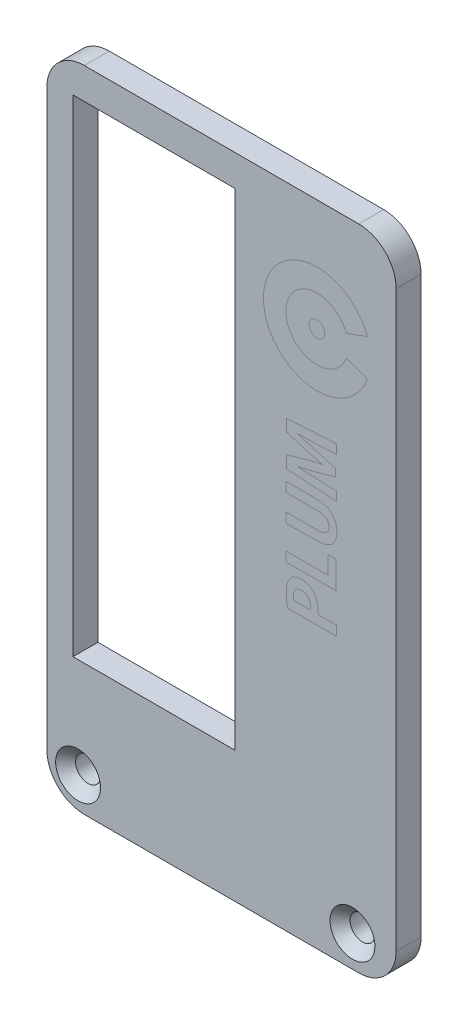
from build123d import *

# Parameters (mm, degrees)
SKETCH_1_W          = 28
SKETCH_1_H          = 52
EXTRUDE_1_DEPTH     = 2
SKETCH_2_R          = 1
CUT_EXTRUDE_1_DEPTH = 2
SKETCH_3_W          = 13
SKETCH_3_H          = 39
CUT_EXTRUDE_2_DEPTH = 2
FILLET_1_R          = 3
CHAMFER_1_SIZE      = 0.8
CUT_EXTRUDE_3_DEPTH = 2
EXTRUDE_2_DEPTH     = 2
SKETCH_6_R          = 0.626877417
CUT_EXTRUDE_4_DEPTH = 2
SKETCH_6_3_R        = 0.626877417
EXTRUDE_4_DEPTH     = 2
CUT_EXTRUDE_7_DEPTH = 2
EXTRUDE_5_DEPTH     = 2
EXTRUDE_5_2_DEPTH   = 2
EXTRUDE_5_3_DEPTH   = 2
EXTRUDE_5_4_DEPTH   = 2


with BuildPart() as part:
    # 草图1 → 凸台-拉伸1 (new body)
    with BuildSketch(Plane.XY):
        Rectangle(SKETCH_1_W, SKETCH_1_H)
    extrude(amount=EXTRUDE_1_DEPTH)

    # 草图2 → 切除-拉伸1 (cut)
    with BuildSketch(Plane.XY.offset(2)):
        with Locations((-11.5, -23.5)):
            Circle(SKETCH_2_R)
        with Locations((10.5, -23.5)):
            Circle(SKETCH_2_R)
    extrude(amount=-CUT_EXTRUDE_1_DEPTH, mode=Mode.SUBTRACT)

    # 草图3 → 切除-拉伸2 (cut)
    with BuildSketch(Plane.XY.offset(2)):
        with Locations((-5.4104633, 4)):
            Rectangle(SKETCH_3_W, SKETCH_3_H)
    extrude(amount=-CUT_EXTRUDE_2_DEPTH, mode=Mode.SUBTRACT)

    # 圆角1
    fillet_1_edges = [part.edges().sort_by_distance(p)[0] for p in [
        (-14, -26, 1),
        (14, -26, 1),
        (14, 26, 1),
        (-14, 26, 1),
    ]]
    fillet(fillet_1_edges, radius=FILLET_1_R)

    # 倒角1
    chamfer_1_edges = [part.edges().sort_by_distance(p)[0] for p in [
        (-12.5, -23.5, 2),
        (9.5, -23.5, 2),
    ]]
    chamfer(chamfer_1_edges, length=CHAMFER_1_SIZE)

    # 草图4 → 切除-拉伸3 (cut)
    with BuildSketch(Plane.XY.offset(2)):
        with BuildLine():
            Line((10.001874871, 17.901227001), (11.690547955, 18.524430993))
            ThreePointArc((11.690547955, 18.524430993), (3.356538696, 17.016411498), (11.703718742, 15.583087248))
            Line((11.703718742, 15.583087248), (10.009532305, 16.191143429))
            ThreePointArc((10.009532305, 16.191143429), (5.156520651, 17.024471481), (10.001874871, 17.901227001))
        make_face()
    extrude(amount=-CUT_EXTRUDE_3_DEPTH, mode=Mode.SUBTRACT)

    # 草图6 → 切除-拉伸4 (cut)
    with BuildSketch(Plane.XY.offset(2)):
        with Locations((7.656495588, 17.035665901)):
            Circle(SKETCH_6_R)
    extrude(amount=-CUT_EXTRUDE_4_DEPTH, mode=Mode.SUBTRACT)

    # 草图7 → 切除-拉伸7 (cut)
    # profile 1 of 4: a face of its own
    with BuildSketch(Plane.XY.offset(2)):
        with BuildLine():
            Line((9.224567312, -2.754985204), (7.723029281, -2.754985204))
            add(Edge.make_bspline(
                [(7.723029281, -2.754985204), (7.726556807, -2.734910954), (7.733977657, -2.692680784), (7.740165236, -2.62613634), (7.744136952, -2.553678568), (7.744142034, -2.503609044), (7.744144688, -2.477458758)],
                knots=[0, 0, 0, 0, 0.877062455, 1.845075036, 2.874526838, 4, 4, 4, 4], degree=3))
            add(Edge.make_bspline(
                [(7.744144688, -2.477458758), (7.744761866, -2.437225534), (7.746001804, -2.356395332), (7.736609044, -2.234814224), (7.717668876, -2.112792971), (7.688752463, -1.990642596), (7.650875383, -1.868232888), (7.6039841, -1.745441449), (7.546893534, -1.622851311), (7.482874728, -1.500234775), (7.405880901, -1.383198746), (7.308990083, -1.280188659), (7.195854553, -1.191449891), (7.065587986, -1.118090926), (6.919673904, -1.058406831), (6.756868185, -1.013664661), (6.577753052, -0.982701427), (6.452413214, -0.974281958), (6.387432522, -0.969917002)],
                knots=[0, 0, 0, 0, 0.84128718, 1.690180573, 2.546870841, 3.421794341, 4.313246192, 5.225301024, 6.168735534, 7.140236699, 8.117328017, 9.088302565, 10.084421092, 11.113561656, 12.205223455, 13.373835019, 14.63850139, 16, 16, 16, 16], degree=3))
            add(Edge.make_bspline(
                [(6.387432522, -0.969917002), (6.341601648, -0.971192097), (6.251770782, -0.973691348), (6.120465814, -0.994186278), (5.995369675, -1.025307686), (5.877633284, -1.070029278), (5.768170286, -1.125764242), (5.668114564, -1.191555085), (5.577509848, -1.267218251), (5.526223597, -1.325910696), (5.500554531, -1.355286605)],
                knots=[0, 0, 0, 0, 1.100414086, 2.156868082, 3.185052495, 4.192238179, 5.175310638, 6.130003319, 7.064055837, 8, 8, 8, 8], degree=3))
            add(Edge.make_bspline(
                [(5.500554531, -1.355286605), (5.47562324, -1.388692876), (5.425022493, -1.456494509), (5.362575853, -1.570489942), (5.309855817, -1.695393788), (5.267138003, -1.83182479), (5.233768151, -1.979583039), (5.212226323, -2.138826289), (5.198014625, -2.309273785), (5.197103456, -2.426647837), (5.196632906, -2.487262681)],
                knots=[0, 0, 0, 0, 0.836606025, 1.697982253, 2.603178176, 3.556730869, 4.566307281, 5.642647, 6.782605007, 8, 8, 8, 8], degree=3))
            add(Edge.make_bspline(
                [(5.196632906, -2.487262681), (5.197118973, -2.540813077), (5.198061676, -2.644671334), (5.203856312, -2.796249277), (5.21054157, -2.938791795), (5.218290488, -3.072882215), (5.229937103, -3.197536044), (5.242608805, -3.313741483), (5.257158918, -3.420979067), (5.269787023, -3.489315105), (5.275818441, -3.521953671)],
                knots=[0, 0, 0, 0, 1.236942669, 2.398987101, 3.50349081, 4.533253662, 5.501087568, 6.394974819, 7.233410034, 8, 8, 8, 8], degree=3))
            Line((5.275818441, -3.521953671), (9.224567312, -3.52120026))
            Line((9.224567312, -3.52120026), (9.224567312, -2.754985204))
        make_face()
        with BuildLine():
            add(Edge.make_bspline(
                [(5.801190015, -2.754985204), (5.796614825, -2.735948789), (5.786175188, -2.69251163), (5.778920182, -2.617830653), (5.771438564, -2.527124741), (5.770366014, -2.461143778), (5.76978535, -2.425422549)],
                knots=[0, 0, 0, 0, 0.707411116, 1.614165824, 2.708340608, 4, 4, 4, 4], degree=3))
            add(Edge.make_bspline(
                [(5.76978535, -2.425422549), (5.770055574, -2.399501658), (5.770584409, -2.348773816), (5.7794984, -2.27499038), (5.791847425, -2.205271436), (5.809970176, -2.14009608), (5.833474564, -2.079218856), (5.862179469, -2.022726518), (5.895543903, -1.969805349), (5.934699396, -1.92188491), (5.978715727, -1.878333901), (6.027871022, -1.840630291), (6.081957602, -1.808497504), (6.141220648, -1.783161304), (6.205088275, -1.762662539), (6.273744341, -1.747645282), (6.347482965, -1.738656292), (6.398216945, -1.736990529), (6.424385772, -1.736131321)],
                knots=[0, 0, 0, 0, 1.150647283, 2.251845908, 3.296564491, 4.293585939, 5.251638342, 6.190496202, 7.10431693, 8.025138136, 8.933209785, 9.848938853, 10.770098533, 11.720244083, 12.705502524, 13.745915437, 14.837332513, 16, 16, 16, 16], degree=3))
            add(Edge.make_bspline(
                [(6.424385772, -1.736131321), (6.451049986, -1.737034193), (6.503270946, -1.738802436), (6.579396235, -1.747352063), (6.650984599, -1.763634428), (6.718165079, -1.785008594), (6.78045417, -1.81362727), (6.839223256, -1.846446717), (6.892834106, -1.886901114), (6.941939514, -1.932879214), (6.985871292, -1.984536854), (7.024601092, -2.041263051), (7.056946492, -2.103384648), (7.08351477, -2.170655567), (7.104436079, -2.242621062), (7.119377109, -2.319876162), (7.129449159, -2.401784577), (7.130988577, -2.458322786), (7.131776551, -2.487262681)],
                knots=[0, 0, 0, 0, 1.095871145, 2.146226514, 3.140886829, 4.107544356, 5.036565894, 5.952407514, 6.867375378, 7.787920949, 8.710896167, 9.647520347, 10.603695434, 11.581704824, 12.614397299, 13.677669427, 14.811281692, 16, 16, 16, 16], degree=3))
            add(Edge.make_bspline(
                [(7.131776551, -2.487262681), (7.131772461, -2.513413064), (7.131764668, -2.563231688), (7.127913009, -2.634189383), (7.121768905, -2.697504308), (7.114198884, -2.73667537), (7.110660408, -2.754985204)],
                knots=[0, 0, 0, 0, 1.166081162, 2.221480295, 3.168661808, 4, 4, 4, 4], degree=3))
            Line((7.110660408, -2.754985204), (5.801190015, -2.754985204))
        make_face(mode=Mode.SUBTRACT)
    # profile 2 of 4: a face of its own
    with BuildSketch(Plane.XY.offset(2)):
        Polygon((8.528175752, 0.382270276), (5.171162738, 0.382270276), (5.171162738, -0.38394478), (9.195408152, -0.38394478), (9.195408152, 1.815777386), (8.528175752, 1.815777386), align=None)
    # profile 3 of 4: a face of its own
    with BuildSketch(Plane.XY.offset(2)):
        with BuildLine():
            Line((5.188276888, 4.442601375), (7.612207093, 4.442601375))
            add(Edge.make_bspline(
                [(7.612207093, 4.442601375), (7.65494803, 4.44177156), (7.737521985, 4.440168387), (7.857053632, 4.430909341), (7.967740453, 4.417270654), (8.069260699, 4.396804698), (8.161602049, 4.371359075), (8.245233171, 4.340786507), (8.319509666, 4.303717412), (8.385236045, 4.261382707), (8.441748701, 4.213310793), (8.491969461, 4.162098413), (8.532247598, 4.104667539), (8.56714198, 4.044300226), (8.592355646, 3.978452724), (8.611570737, 3.909105853), (8.622171946, 3.834836889), (8.623036127, 3.78401233), (8.623481199, 3.757836508)],
                knots=[0, 0, 0, 0, 1.481883634, 2.862945906, 4.154826069, 5.346215526, 6.450063801, 7.473233258, 8.428200081, 9.322663588, 10.176367081, 10.996254644, 11.801747258, 12.601751253, 13.407762399, 14.238693956, 15.092886716, 16, 16, 16, 16], degree=3))
            add(Edge.make_bspline(
                [(8.623481199, 3.757836508), (8.623105058, 3.732902529), (8.622367549, 3.684013877), (8.610605542, 3.6129024), (8.59179895, 3.545776491), (8.564978459, 3.482554259), (8.531132164, 3.422860294), (8.489323701, 3.367068533), (8.438541607, 3.316597889), (8.381230798, 3.26868107), (8.315379974, 3.225543124), (8.240525454, 3.188670593), (8.157266753, 3.15689571), (8.064943374, 3.131806427), (7.964163526, 3.111495182), (7.854618968, 3.096486599), (7.736241199, 3.087680437), (7.654415777, 3.08600274), (7.612168796, 3.085136535)],
                knots=[0, 0, 0, 0, 0.872717099, 1.711157419, 2.516945564, 3.310362728, 4.111176974, 4.916242676, 5.744629168, 6.61414003, 7.530271028, 8.495355153, 9.532473613, 10.648016501, 11.843394681, 13.132666545, 14.519577664, 16, 16, 16, 16], degree=3))
            Line((7.612168796, 3.085136535), (5.188276888, 3.085136535))
            Line((5.188276888, 3.085136535), (5.188276888, 2.318921479))
            Line((5.188276888, 2.318921479), (7.544441302, 2.318921479))
            add(Edge.make_bspline(
                [(7.544441302, 2.318921479), (7.615064667, 2.320092169), (7.752058515, 2.322363049), (7.950128668, 2.339412999), (8.133860441, 2.368772188), (8.302922789, 2.409067346), (8.458006863, 2.460405752), (8.599094324, 2.522102198), (8.724511882, 2.597877331), (8.836424267, 2.683041365), (8.933846259, 2.779987889), (9.017985328, 2.886969924), (9.089458793, 3.004133983), (9.147682019, 3.131450433), (9.192037415, 3.268989879), (9.223371772, 3.416040909), (9.242820525, 3.573047345), (9.244192826, 3.681105736), (9.244899112, 3.736720365)],
                knots=[0, 0, 0, 0, 1.337524362, 2.594504072, 3.761585457, 4.858651196, 5.882479242, 6.85223788, 7.768398263, 8.651190312, 9.509702829, 10.36409947, 11.223126735, 12.103025156, 13.009434111, 13.954508992, 14.947243024, 16, 16, 16, 16], degree=3))
            add(Edge.make_bspline(
                [(9.244899112, 3.736720365), (9.243864404, 3.793085631), (9.241848845, 3.902882274), (9.222632273, 4.062652379), (9.191282377, 4.21302761), (9.146409126, 4.353890329), (9.086672964, 4.484391469), (9.015943447, 4.606211459), (8.930681528, 4.717774771), (8.832065137, 4.8193808), (8.71992531, 4.910419685), (8.593155631, 4.989343719), (8.45220884, 5.056409444), (8.296901551, 5.111111807), (8.127530727, 5.154082306), (7.944115883, 5.18434127), (7.746292377, 5.203274854), (7.609699099, 5.206430219), (7.539016445, 5.208063019)],
                knots=[0, 0, 0, 0, 1.051511199, 2.048289845, 2.997825919, 3.91467537, 4.800664648, 5.671218089, 6.538186984, 7.414033205, 8.307886667, 9.226846025, 10.194166529, 11.215029432, 12.294813379, 13.450900938, 14.680922724, 16, 16, 16, 16], degree=3))
            Line((7.539016445, 5.208063019), (5.188276888, 5.208816431))
            Line((5.188276888, 5.208816431), (5.188276888, 4.442601375))
        make_face()
    # profile 4 of 4: a face of its own
    with BuildSketch(Plane.XY.offset(2)):
        with BuildLine():
            Line((5.196633643, 8.658695695), (6.695335518, 8.204801734))
            add(Edge.make_bspline(
                [(6.695335518, 8.204801734), (6.815807413, 8.171246442), (7.054280803, 8.104823944), (7.41041406, 8.014152054), (7.760381809, 7.929544473), (7.992650251, 7.879766767), (8.107644, 7.85512233)],
                knots=[0, 0, 0, 0, 1.031209753, 2.041273477, 3.030254364, 4, 4, 4, 4], degree=3))
            Line((8.107644, 7.85512233), (8.107991615, 7.839599697))
            add(Edge.make_bspline(
                [(8.107991615, 7.839599697), (7.992386878, 7.816098981), (7.75928919, 7.768713703), (7.408614859, 7.688079387), (7.053035862, 7.600878946), (6.815177657, 7.537291698), (6.695124887, 7.505197681)],
                knots=[0, 0, 0, 0, 0.974792936, 1.965507516, 2.973142592, 4, 4, 4, 4], degree=3))
            Line((6.695124887, 7.505197681), (5.196633643, 7.072675418))
            Line((5.196633643, 7.072675418), (5.196633643, 6.117932949))
            Line((5.196633643, 6.117932949), (9.197457019, 5.846825598))
            Line((9.197457019, 5.846825598), (9.197457019, 6.550958222))
            Line((9.197457019, 6.550958222), (7.654482093, 6.629215801))
            add(Edge.make_bspline(
                [(7.654482093, 6.629215801), (7.525254072, 6.63584842), (7.260584822, 6.649432549), (6.859818516, 6.666005134), (6.457390382, 6.681724841), (6.190358295, 6.688264377), (6.059378163, 6.691472041)],
                knots=[0, 0, 0, 0, 0.972684063, 1.992134205, 3.015135118, 4, 4, 4, 4], degree=3))
            Line((6.059378163, 6.691472041), (6.059379636, 6.707473381))
            add(Edge.make_bspline(
                [(6.059379636, 6.707473381), (6.184439084, 6.731971204), (6.437407036, 6.781524951), (6.814369307, 6.866587919), (7.184925817, 6.956217433), (7.426572089, 7.023635452), (7.54429548, 7.056479649)],
                knots=[0, 0, 0, 0, 1.002162323, 2.027155512, 3.03888464, 4, 4, 4, 4], degree=3))
            Line((7.54429548, 7.056479649), (9.140116735, 7.500483519))
            Line((9.140116735, 7.500483519), (9.140116735, 8.084806779))
            Line((9.140116735, 8.084806779), (7.518950512, 8.575220944))
            add(Edge.make_bspline(
                [(7.518950512, 8.575220944), (7.402284705, 8.609702782), (7.163426033, 8.680300041), (6.799473234, 8.782559715), (6.429661163, 8.880440465), (6.18189425, 8.941211274), (6.059378163, 8.971261299)],
                knots=[0, 0, 0, 0, 0.965166448, 1.976057779, 2.999198567, 4, 4, 4, 4], degree=3))
            Line((6.059378163, 8.971261299), (6.059379636, 8.987377529))
            add(Edge.make_bspline(
                [(6.059379636, 8.987377529), (6.114432596, 8.986782002), (6.229067556, 8.985541956), (6.408055033, 8.988705807), (6.601133806, 8.992020868), (6.875637596, 9.000619848), (7.223066832, 9.012169025), (7.501313997, 9.023156695), (7.638563974, 9.028576543)],
                knots=[0, 0, 0, 0, 0.627240715, 1.30608261, 2.039427526, 2.827383376, 4.435054818, 6, 6, 6, 6], degree=3))
            Line((7.638563974, 9.028576543), (9.197457019, 9.102155312))
            Line((9.197457019, 9.102155312), (9.197457019, 9.837776559))
            Line((9.197457019, 9.837776559), (5.196633643, 9.608220993))
            Line((5.196633643, 9.608220993), (5.196633643, 8.658695695))
        make_face()
    extrude(amount=-CUT_EXTRUDE_7_DEPTH, mode=Mode.SUBTRACT)


with BuildPart() as body_2:
    # 草图5 → 凸台-拉伸2 (new body)
    with BuildSketch(Plane.XY.offset(2)):
        with BuildLine():
            Line((11.703718742, 15.583087248), (10.009532305, 16.191143429))
            ThreePointArc((10.009532305, 16.191143429), (5.156520651, 17.024471481), (10.001874871, 17.901227001))
            Line((10.001874871, 17.901227001), (11.690547955, 18.524430993))
            ThreePointArc((11.690547955, 18.524430993), (3.356538696, 17.016411498), (11.703718742, 15.583087248))
        make_face()
    extrude(amount=-EXTRUDE_2_DEPTH)


with BuildPart() as body_3:
    # 草图6<3> → 凸台-拉伸4 (new body)
    with BuildSketch(Plane.XY.offset(2)):
        with Locations((7.656495588, 17.035665901)):
            Circle(SKETCH_6_3_R)
    extrude(amount=-EXTRUDE_4_DEPTH)


with BuildPart() as cut_extrude_7_piece_1:
    # of the separate pieces the step leaves, piece 1, a body of its own (cut_extrude_7_pieces)
    add(part.part.solids().sort_by_distance((-11, -26, 2))[0])


with BuildPart() as cut_extrude_7_piece_2:
    # of the separate pieces the step leaves, piece 2, a body of its own (cut_extrude_7_pieces)
    add(part.part.solids().sort_by_distance((5.801190015, -2.754985204, 2))[0])


with BuildPart() as body_5:
    # 草图7<2> → 凸台-拉伸5 (new body)
    with BuildSketch(Plane.XY.offset(2)):
        with BuildLine():
            Line((9.224567312, -2.754985204), (7.723029281, -2.754985204))
            add(Edge.make_bspline(
                [(7.723029281, -2.754985204), (7.726556807, -2.734910954), (7.733977657, -2.692680784), (7.740165236, -2.62613634), (7.744136952, -2.553678568), (7.744142034, -2.503609044), (7.744144688, -2.477458758)],
                knots=[0, 0, 0, 0, 0.877062455, 1.845075036, 2.874526838, 4, 4, 4, 4], degree=3))
            add(Edge.make_bspline(
                [(7.744144688, -2.477458758), (7.744761866, -2.437225534), (7.746001804, -2.356395332), (7.736609044, -2.234814224), (7.717668876, -2.112792971), (7.688752463, -1.990642596), (7.650875383, -1.868232888), (7.6039841, -1.745441449), (7.546893534, -1.622851311), (7.482874728, -1.500234775), (7.405880901, -1.383198746), (7.308990083, -1.280188659), (7.195854553, -1.191449891), (7.065587986, -1.118090926), (6.919673904, -1.058406831), (6.756868185, -1.013664661), (6.577753052, -0.982701427), (6.452413214, -0.974281958), (6.387432522, -0.969917002)],
                knots=[0, 0, 0, 0, 0.84128718, 1.690180573, 2.546870841, 3.421794341, 4.313246192, 5.225301024, 6.168735534, 7.140236699, 8.117328017, 9.088302565, 10.084421092, 11.113561656, 12.205223455, 13.373835019, 14.63850139, 16, 16, 16, 16], degree=3))
            add(Edge.make_bspline(
                [(6.387432522, -0.969917002), (6.341601648, -0.971192097), (6.251770782, -0.973691348), (6.120465814, -0.994186278), (5.995369675, -1.025307686), (5.877633284, -1.070029278), (5.768170286, -1.125764242), (5.668114564, -1.191555085), (5.577509848, -1.267218251), (5.526223597, -1.325910696), (5.500554531, -1.355286605)],
                knots=[0, 0, 0, 0, 1.100414086, 2.156868082, 3.185052495, 4.192238179, 5.175310638, 6.130003319, 7.064055837, 8, 8, 8, 8], degree=3))
            add(Edge.make_bspline(
                [(5.500554531, -1.355286605), (5.47562324, -1.388692876), (5.425022493, -1.456494509), (5.362575853, -1.570489942), (5.309855817, -1.695393788), (5.267138003, -1.83182479), (5.233768151, -1.979583039), (5.212226323, -2.138826289), (5.198014625, -2.309273785), (5.197103456, -2.426647837), (5.196632906, -2.487262681)],
                knots=[0, 0, 0, 0, 0.836606025, 1.697982253, 2.603178176, 3.556730869, 4.566307281, 5.642647, 6.782605007, 8, 8, 8, 8], degree=3))
            add(Edge.make_bspline(
                [(5.196632906, -2.487262681), (5.197118973, -2.540813077), (5.198061676, -2.644671334), (5.203856312, -2.796249277), (5.21054157, -2.938791795), (5.218290488, -3.072882215), (5.229937103, -3.197536044), (5.242608805, -3.313741483), (5.257158918, -3.420979067), (5.269787023, -3.489315105), (5.275818441, -3.521953671)],
                knots=[0, 0, 0, 0, 1.236942669, 2.398987101, 3.50349081, 4.533253662, 5.501087568, 6.394974819, 7.233410034, 8, 8, 8, 8], degree=3))
            Line((5.275818441, -3.521953671), (9.224567312, -3.52120026))
            Line((9.224567312, -3.52120026), (9.224567312, -2.754985204))
        make_face()
        with BuildLine():
            add(Edge.make_bspline(
                [(5.801190015, -2.754985204), (5.796614825, -2.735948789), (5.786175188, -2.69251163), (5.778920182, -2.617830653), (5.771438564, -2.527124741), (5.770366014, -2.461143778), (5.76978535, -2.425422549)],
                knots=[0, 0, 0, 0, 0.707411116, 1.614165824, 2.708340608, 4, 4, 4, 4], degree=3))
            add(Edge.make_bspline(
                [(5.76978535, -2.425422549), (5.770055574, -2.399501658), (5.770584409, -2.348773816), (5.7794984, -2.27499038), (5.791847425, -2.205271436), (5.809970176, -2.14009608), (5.833474564, -2.079218856), (5.862179469, -2.022726518), (5.895543903, -1.969805349), (5.934699396, -1.92188491), (5.978715727, -1.878333901), (6.027871022, -1.840630291), (6.081957602, -1.808497504), (6.141220648, -1.783161304), (6.205088275, -1.762662539), (6.273744341, -1.747645282), (6.347482965, -1.738656292), (6.398216945, -1.736990529), (6.424385772, -1.736131321)],
                knots=[0, 0, 0, 0, 1.150647283, 2.251845908, 3.296564491, 4.293585939, 5.251638342, 6.190496202, 7.10431693, 8.025138136, 8.933209785, 9.848938853, 10.770098533, 11.720244083, 12.705502524, 13.745915437, 14.837332513, 16, 16, 16, 16], degree=3))
            add(Edge.make_bspline(
                [(6.424385772, -1.736131321), (6.451049986, -1.737034193), (6.503270946, -1.738802436), (6.579396235, -1.747352063), (6.650984599, -1.763634428), (6.718165079, -1.785008594), (6.78045417, -1.81362727), (6.839223256, -1.846446717), (6.892834106, -1.886901114), (6.941939514, -1.932879214), (6.985871292, -1.984536854), (7.024601092, -2.041263051), (7.056946492, -2.103384648), (7.08351477, -2.170655567), (7.104436079, -2.242621062), (7.119377109, -2.319876162), (7.129449159, -2.401784577), (7.130988577, -2.458322786), (7.131776551, -2.487262681)],
                knots=[0, 0, 0, 0, 1.095871145, 2.146226514, 3.140886829, 4.107544356, 5.036565894, 5.952407514, 6.867375378, 7.787920949, 8.710896167, 9.647520347, 10.603695434, 11.581704824, 12.614397299, 13.677669427, 14.811281692, 16, 16, 16, 16], degree=3))
            add(Edge.make_bspline(
                [(7.131776551, -2.487262681), (7.131772461, -2.513413064), (7.131764668, -2.563231688), (7.127913009, -2.634189383), (7.121768905, -2.697504308), (7.114198884, -2.73667537), (7.110660408, -2.754985204)],
                knots=[0, 0, 0, 0, 1.166081162, 2.221480295, 3.168661808, 4, 4, 4, 4], degree=3))
            Line((7.110660408, -2.754985204), (5.801190015, -2.754985204))
        make_face(mode=Mode.SUBTRACT)
    extrude(amount=-EXTRUDE_5_DEPTH)


with BuildPart() as body_6:
    # 草图7<2> → Extrude 5 2 (new body)
    with BuildSketch(Plane.XY.offset(2)):
        Polygon((8.528175752, 0.382270276), (5.171162738, 0.382270276), (5.171162738, -0.38394478), (9.195408152, -0.38394478), (9.195408152, 1.815777386), (8.528175752, 1.815777386), align=None)
    extrude(amount=-EXTRUDE_5_2_DEPTH)


with BuildPart() as body_7:
    # 草图7<2> → Extrude 5 3 (new body)
    with BuildSketch(Plane.XY.offset(2)):
        with BuildLine():
            Line((5.188276888, 4.442601375), (7.612207093, 4.442601375))
            add(Edge.make_bspline(
                [(7.612207093, 4.442601375), (7.65494803, 4.44177156), (7.737521985, 4.440168387), (7.857053632, 4.430909341), (7.967740453, 4.417270654), (8.069260699, 4.396804698), (8.161602049, 4.371359075), (8.245233171, 4.340786507), (8.319509666, 4.303717412), (8.385236045, 4.261382707), (8.441748701, 4.213310793), (8.491969461, 4.162098413), (8.532247598, 4.104667539), (8.56714198, 4.044300226), (8.592355646, 3.978452724), (8.611570737, 3.909105853), (8.622171946, 3.834836889), (8.623036127, 3.78401233), (8.623481199, 3.757836508)],
                knots=[0, 0, 0, 0, 1.481883634, 2.862945906, 4.154826069, 5.346215526, 6.450063801, 7.473233258, 8.428200081, 9.322663588, 10.176367081, 10.996254644, 11.801747258, 12.601751253, 13.407762399, 14.238693956, 15.092886716, 16, 16, 16, 16], degree=3))
            add(Edge.make_bspline(
                [(8.623481199, 3.757836508), (8.623105058, 3.732902529), (8.622367549, 3.684013877), (8.610605542, 3.6129024), (8.59179895, 3.545776491), (8.564978459, 3.482554259), (8.531132164, 3.422860294), (8.489323701, 3.367068533), (8.438541607, 3.316597889), (8.381230798, 3.26868107), (8.315379974, 3.225543124), (8.240525454, 3.188670593), (8.157266753, 3.15689571), (8.064943374, 3.131806427), (7.964163526, 3.111495182), (7.854618968, 3.096486599), (7.736241199, 3.087680437), (7.654415777, 3.08600274), (7.612168796, 3.085136535)],
                knots=[0, 0, 0, 0, 0.872717099, 1.711157419, 2.516945564, 3.310362728, 4.111176974, 4.916242676, 5.744629168, 6.61414003, 7.530271028, 8.495355153, 9.532473613, 10.648016501, 11.843394681, 13.132666545, 14.519577664, 16, 16, 16, 16], degree=3))
            Line((7.612168796, 3.085136535), (5.188276888, 3.085136535))
            Line((5.188276888, 3.085136535), (5.188276888, 2.318921479))
            Line((5.188276888, 2.318921479), (7.544441302, 2.318921479))
            add(Edge.make_bspline(
                [(7.544441302, 2.318921479), (7.615064667, 2.320092169), (7.752058515, 2.322363049), (7.950128668, 2.339412999), (8.133860441, 2.368772188), (8.302922789, 2.409067346), (8.458006863, 2.460405752), (8.599094324, 2.522102198), (8.724511882, 2.597877331), (8.836424267, 2.683041365), (8.933846259, 2.779987889), (9.017985328, 2.886969924), (9.089458793, 3.004133983), (9.147682019, 3.131450433), (9.192037415, 3.268989879), (9.223371772, 3.416040909), (9.242820525, 3.573047345), (9.244192826, 3.681105736), (9.244899112, 3.736720365)],
                knots=[0, 0, 0, 0, 1.337524362, 2.594504072, 3.761585457, 4.858651196, 5.882479242, 6.85223788, 7.768398263, 8.651190312, 9.509702829, 10.36409947, 11.223126735, 12.103025156, 13.009434111, 13.954508992, 14.947243024, 16, 16, 16, 16], degree=3))
            add(Edge.make_bspline(
                [(9.244899112, 3.736720365), (9.243864404, 3.793085631), (9.241848845, 3.902882274), (9.222632273, 4.062652379), (9.191282377, 4.21302761), (9.146409126, 4.353890329), (9.086672964, 4.484391469), (9.015943447, 4.606211459), (8.930681528, 4.717774771), (8.832065137, 4.8193808), (8.71992531, 4.910419685), (8.593155631, 4.989343719), (8.45220884, 5.056409444), (8.296901551, 5.111111807), (8.127530727, 5.154082306), (7.944115883, 5.18434127), (7.746292377, 5.203274854), (7.609699099, 5.206430219), (7.539016445, 5.208063019)],
                knots=[0, 0, 0, 0, 1.051511199, 2.048289845, 2.997825919, 3.91467537, 4.800664648, 5.671218089, 6.538186984, 7.414033205, 8.307886667, 9.226846025, 10.194166529, 11.215029432, 12.294813379, 13.450900938, 14.680922724, 16, 16, 16, 16], degree=3))
            Line((7.539016445, 5.208063019), (5.188276888, 5.208816431))
            Line((5.188276888, 5.208816431), (5.188276888, 4.442601375))
        make_face()
    extrude(amount=-EXTRUDE_5_3_DEPTH)


with BuildPart() as body_8:
    # 草图7<2> → Extrude 5 4 (new body)
    with BuildSketch(Plane.XY.offset(2)):
        with BuildLine():
            Line((5.196633643, 8.658695695), (6.695335518, 8.204801734))
            add(Edge.make_bspline(
                [(6.695335518, 8.204801734), (6.815807413, 8.171246442), (7.054280803, 8.104823944), (7.41041406, 8.014152054), (7.760381809, 7.929544473), (7.992650251, 7.879766767), (8.107644, 7.85512233)],
                knots=[0, 0, 0, 0, 1.031209753, 2.041273477, 3.030254364, 4, 4, 4, 4], degree=3))
            Line((8.107644, 7.85512233), (8.107991615, 7.839599697))
            add(Edge.make_bspline(
                [(8.107991615, 7.839599697), (7.992386878, 7.816098981), (7.75928919, 7.768713703), (7.408614859, 7.688079387), (7.053035862, 7.600878946), (6.815177657, 7.537291698), (6.695124887, 7.505197681)],
                knots=[0, 0, 0, 0, 0.974792936, 1.965507516, 2.973142592, 4, 4, 4, 4], degree=3))
            Line((6.695124887, 7.505197681), (5.196633643, 7.072675418))
            Line((5.196633643, 7.072675418), (5.196633643, 6.117932949))
            Line((5.196633643, 6.117932949), (9.197457019, 5.846825598))
            Line((9.197457019, 5.846825598), (9.197457019, 6.550958222))
            Line((9.197457019, 6.550958222), (7.654482093, 6.629215801))
            add(Edge.make_bspline(
                [(7.654482093, 6.629215801), (7.525254072, 6.63584842), (7.260584822, 6.649432549), (6.859818516, 6.666005134), (6.457390382, 6.681724841), (6.190358295, 6.688264377), (6.059378163, 6.691472041)],
                knots=[0, 0, 0, 0, 0.972684063, 1.992134205, 3.015135118, 4, 4, 4, 4], degree=3))
            Line((6.059378163, 6.691472041), (6.059379636, 6.707473381))
            add(Edge.make_bspline(
                [(6.059379636, 6.707473381), (6.184439084, 6.731971204), (6.437407036, 6.781524951), (6.814369307, 6.866587919), (7.184925817, 6.956217433), (7.426572089, 7.023635452), (7.54429548, 7.056479649)],
                knots=[0, 0, 0, 0, 1.002162323, 2.027155512, 3.03888464, 4, 4, 4, 4], degree=3))
            Line((7.54429548, 7.056479649), (9.140116735, 7.500483519))
            Line((9.140116735, 7.500483519), (9.140116735, 8.084806779))
            Line((9.140116735, 8.084806779), (7.518950512, 8.575220944))
            add(Edge.make_bspline(
                [(7.518950512, 8.575220944), (7.402284705, 8.609702782), (7.163426033, 8.680300041), (6.799473234, 8.782559715), (6.429661163, 8.880440465), (6.18189425, 8.941211274), (6.059378163, 8.971261299)],
                knots=[0, 0, 0, 0, 0.965166448, 1.976057779, 2.999198567, 4, 4, 4, 4], degree=3))
            Line((6.059378163, 8.971261299), (6.059379636, 8.987377529))
            add(Edge.make_bspline(
                [(6.059379636, 8.987377529), (6.114432596, 8.986782002), (6.229067556, 8.985541956), (6.408055033, 8.988705807), (6.601133806, 8.992020868), (6.875637596, 9.000619848), (7.223066832, 9.012169025), (7.501313997, 9.023156695), (7.638563974, 9.028576543)],
                knots=[0, 0, 0, 0, 0.627240715, 1.30608261, 2.039427526, 2.827383376, 4.435054818, 6, 6, 6, 6], degree=3))
            Line((7.638563974, 9.028576543), (9.197457019, 9.102155312))
            Line((9.197457019, 9.102155312), (9.197457019, 9.837776559))
            Line((9.197457019, 9.837776559), (5.196633643, 9.608220993))
            Line((5.196633643, 9.608220993), (5.196633643, 8.658695695))
        make_face()
    extrude(amount=-EXTRUDE_5_4_DEPTH)


solid = Compound([body_2.part, body_3.part, cut_extrude_7_piece_1.part, cut_extrude_7_piece_2.part, body_5.part, body_6.part, body_7.part, body_8.part])
